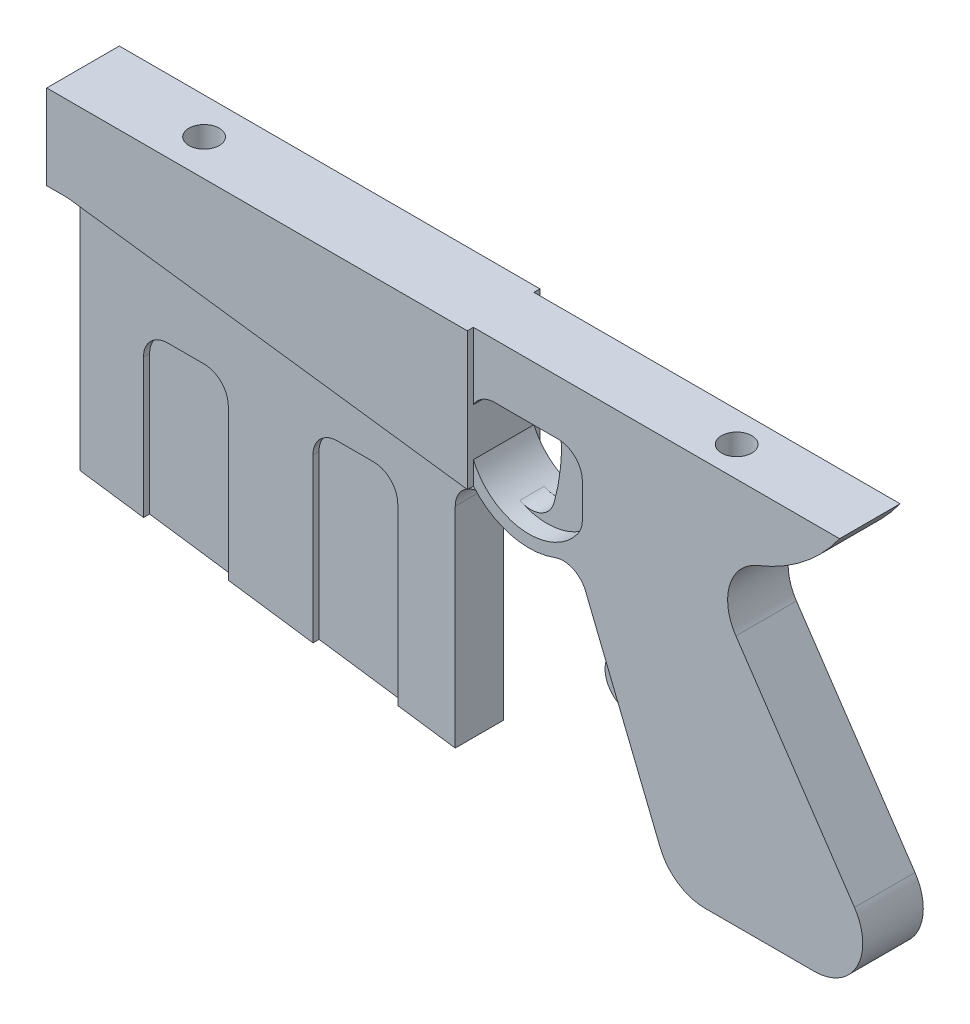
from build123d import *

# Parameters (mm, degrees)
EXTRUDE_8_DEPTH        = 4
EXTRUDE_8_DEPTH_BACK   = 4
EXTRUDE_9_DEPTH        = 5
EXTRUDE_9_DEPTH_BACK   = 5
EXTRUDE_10_DEPTH       = 2
EXTRUDE_10_DEPTH_BACK  = 2
EXTRUDE_11_DEPTH       = 3
EXTRUDE_11_DEPTH_BACK  = 3
EXTRUDE_12_DEPTH       = 3
EXTRUDE_12_DEPTH_BACK  = 3
EXTRUDE_13_DEPTH       = 6
EXTRUDE_13_DEPTH_BACK  = 6
HOLE_WIZARD_M6_2_D     = 5
HOLE_WIZARD_M6_2_DEPTH = 15
HOLE_WIZARD_M6_2_TIP   = 1.502151548


with BuildPart() as part:
    # 草图1 → 凸台-拉伸8 (new, two sides: drawn at the far end of the back side and taken through both)
    with BuildSketch(Plane.XY.offset(-EXTRUDE_8_DEPTH_BACK)):
        with BuildLine():
            Line((69.5, 0), (0, 0))
            Line((0, 0), (0, -14))
            Line((0, -14), (3.5, -14))
            Line((3.5, -14), (3.5, -54))
            Line((3.5, -54), (14, -55.475678764))
            Line((14, -55.475678764), (14, -32.5))
            ThreePointArc((14, -32.5), (15.171572875, -29.671572875), (18, -28.5))
            Line((18, -28.5), (24, -28.5))
            ThreePointArc((24, -28.5), (26.828427125, -29.671572875), (28, -32.5))
            Line((28, -32.5), (28, -57.44325045))
            Line((28, -57.44325045), (42, -59.410822136))
            Line((42, -59.410822136), (42, -32.5))
            ThreePointArc((42, -32.5), (43.171572875, -29.671572875), (46, -28.5))
            Line((46, -28.5), (52, -28.5))
            ThreePointArc((52, -28.5), (54.828427125, -29.671572875), (56, -32.5))
            Line((56, -32.5), (56, -61.378393822))
            Line((56, -61.378393822), (65.5, -62.713531752))
            Line((65.5, -62.713531752), (65.5, -28.095746335))
            ThreePointArc((65.5, -28.095746335), (67.655069896, -24.546629134), (71.798116456, -24.821809752))
            ThreePointArc((71.798116456, -24.821809752), (70.580276552, -23.842645827), (69.5, -22.713531752))
            Line((69.5, -22.713531752), (69.5, -18.936822587))
            ThreePointArc((69.5, -18.936822587), (69.221207402, -18.208623367), (69, -17.460915736))
            Line((69, -17.460915736), (69, -13))
            ThreePointArc((69, -13), (69.127016654, -12), (69.5, -11.063508327))
            Line((69.5, -11.063508327), (69.5, 0))
        make_face()
    extrude(amount=EXTRUDE_8_DEPTH + EXTRUDE_8_DEPTH_BACK)

    # 草图1<10> → 凸台-拉伸9 (add, two sides: drawn at the far end of the back side and taken through both)
    with BuildSketch(Plane.XY.offset(-EXTRUDE_9_DEPTH_BACK)):
        with BuildLine():
            Line((130, 0), (69.5, 0))
            Line((69.5, 0), (69.5, -11.063508327))
            ThreePointArc((69.5, -11.063508327), (70.968493994, -9.554280431), (73, -9))
            Line((73, -9), (77.08693273, -9))
            Line((77.08693273, -9), (83.5, -9))
            ThreePointArc((83.5, -9), (86.328427125, -10.171572875), (87.5, -13))
            Line((87.5, -13), (87.5, -18.58993247))
            ThreePointArc((87.5, -18.58993247), (87.296056581, -19.850866423), (86.705022784, -20.983220784))
            ThreePointArc((86.705022784, -20.983220784), (80.974921845, -24.736035873), (74.173945542, -23.920929013))
            ThreePointArc((74.173945542, -23.920929013), (71.398076595, -21.840459472), (69.5, -18.936822587))
            Line((69.5, -18.936822587), (69.5, -22.713531752))
            ThreePointArc((69.5, -22.713531752), (70.580276552, -23.842645827), (71.798116456, -24.821809752))
            ThreePointArc((71.798116456, -24.821809752), (77.179945202, -26.904296761), (82.91155309, -26.233846298))
            ThreePointArc((82.91155309, -26.233846298), (85.926197724, -26.316026977), (88.02665093, -28.480035357))
            Line((88.02665093, -28.480035357), (90.262355313, -34.013597882))
            Line((90.262355313, -34.013597882), (95.364949439, -46.642961524))
            Line((95.364949439, -46.642961524), (100.356245485, -58.996852747))
            ThreePointArc((100.356245485, -58.996852747), (103.300173094, -62.63230058), (107.773716321, -64))
            Line((107.773716321, -64), (125.831836464, -64))
            ThreePointArc((125.831836464, -64), (132.895417207, -59.755772502), (132.464137044, -51.526456772))
            Line((132.464137044, -51.526456772), (112.86769942, -22.473543228))
            ThreePointArc((112.86769942, -22.473543228), (111.857848283, -15.634092747), (116.555476326, -10.561600956))
            ThreePointArc((116.555476326, -10.561600956), (124.046039774, -6.258819743), (130, 0))
        make_face()
    extrude(amount=EXTRUDE_9_DEPTH + EXTRUDE_9_DEPTH_BACK)

    # 草图1<11> → 凸台-拉伸10 (add, two sides: drawn at the far end of the back side and taken through both)
    with BuildSketch(Plane.XY.offset(-EXTRUDE_10_DEPTH_BACK)):
        with BuildLine():
            ThreePointArc((79.837012191, -21.417403525), (77.598679354, -24.011007569), (74.173945542, -23.920929013))
            ThreePointArc((74.173945542, -23.920929013), (80.974921845, -24.736035873), (86.705022784, -20.983220784))
            ThreePointArc((86.705022784, -20.983220784), (87.296056581, -19.850866423), (87.5, -18.58993247))
            Line((87.5, -18.58993247), (87.5, -13))
            ThreePointArc((87.5, -13), (86.328427125, -10.171572875), (83.5, -9))
            Line((83.5, -9), (77.08693273, -9))
            ThreePointArc((77.08693273, -9), (79.956123916, -10.212933095), (81.08524663, -13.116129032))
            ThreePointArc((81.08524663, -13.116129032), (80.710908742, -17.304324748), (79.837012191, -21.417403525))
        make_face()
    extrude(amount=EXTRUDE_10_DEPTH + EXTRUDE_10_DEPTH_BACK)

    # 草图1<12> → 凸台-拉伸11 (add, two sides: drawn at the far end of the back side and taken through both)
    with BuildSketch(Plane.XY.offset(-EXTRUDE_11_DEPTH_BACK)):
        with BuildLine():
            Line((95.364949439, -46.642961524), (90.262355313, -34.013597882))
            ThreePointArc((90.262355313, -34.013597882), (90.537164852, -35.874473659), (89.931018667, -37.655194228))
            ThreePointArc((89.931018667, -37.655194228), (89.568508885, -41.63940278), (92.596940419, -44.25358211))
            ThreePointArc((92.596940419, -44.25358211), (94.269957944, -45.113460767), (95.364949439, -46.642961524))
        make_face()
    extrude(amount=EXTRUDE_11_DEPTH + EXTRUDE_11_DEPTH_BACK)

    # 草图1<13> → 凸台-拉伸12 (add, two sides: drawn at the far end of the back side and taken through both)
    with BuildSketch(Plane.XY.offset(-EXTRUDE_12_DEPTH_BACK)):
        with BuildLine():
            Line((14, -32.5), (14, -55.475678764))
            Line((14, -55.475678764), (28, -57.44325045))
            Line((28, -57.44325045), (28, -32.5))
            ThreePointArc((28, -32.5), (26.828427125, -29.671572875), (24, -28.5))
            Line((24, -28.5), (18, -28.5))
            ThreePointArc((18, -28.5), (15.171572875, -29.671572875), (14, -32.5))
        make_face()
        with BuildLine():
            Line((42, -32.5), (42, -59.410822136))
            Line((42, -59.410822136), (56, -61.378393822))
            Line((56, -61.378393822), (56, -32.5))
            ThreePointArc((56, -32.5), (54.828427125, -29.671572875), (52, -28.5))
            Line((52, -28.5), (46, -28.5))
            ThreePointArc((46, -28.5), (43.171572875, -29.671572875), (42, -32.5))
        make_face()
    extrude(amount=EXTRUDE_12_DEPTH + EXTRUDE_12_DEPTH_BACK)

    # 草图13 → 凸台-拉伸13 (add, two sides: drawn at the far end of the back side and taken through both)
    with BuildSketch(Plane.XY.offset(-EXTRUDE_13_DEPTH_BACK)):
        Polygon((69.5, 0), (69.5, -22.713531752), (3.5, -14), (0, -14), (0, 0), align=None)
    extrude(amount=EXTRUDE_13_DEPTH + EXTRUDE_13_DEPTH_BACK)

    # M6 螺纹孔2
    with Locations(Plane(origin=(0, 0, 0), x_dir=(1, 0, 0), z_dir=(0, 1, 0))):
        with Locations((20, 0), (108, 0)):
            Hole(HOLE_WIZARD_M6_2_D / 2, depth=HOLE_WIZARD_M6_2_DEPTH)
            with Locations((0, 0, -(HOLE_WIZARD_M6_2_DEPTH + HOLE_WIZARD_M6_2_TIP / 2))):  # 118° drill point
                Cone(0, HOLE_WIZARD_M6_2_D / 2, HOLE_WIZARD_M6_2_TIP, mode=Mode.SUBTRACT)


solid = part.part
